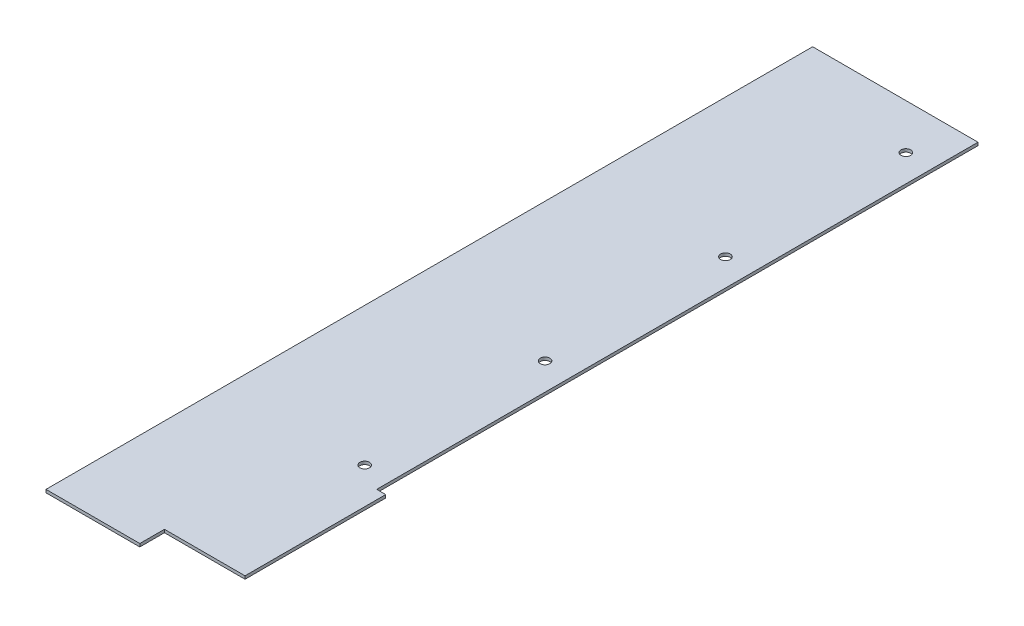
from build123d import *

# Parameters (mm, degrees)
ESQUISSE1_R        = 1.6
BOSS_EXTRU_1_DEPTH = 1


with BuildPart() as part:
    # Esquisse1 → Boss.-Extru.1 (new body)
    with BuildSketch(Plane(origin=(0, 0, 0), x_dir=(1, 0, 0), z_dir=(0, 1, 0))):
        Polygon((0, 0), (0, 255), (55, 255), (55, 55), (58, 55), (58, 8.2), (55, 8.2), (31.2, 8.2), (31.2, 0), align=None)
        with Locations(Location((46, 60, 0), (0, 0, 270))):
            Circle(ESQUISSE1_R, mode=Mode.SUBTRACT)
        with Locations(Location((46, 120, 0), (0, 0, 270))):
            Circle(ESQUISSE1_R, mode=Mode.SUBTRACT)
        with Locations(Location((46, 180, 0), (0, 0, 270))):
            Circle(ESQUISSE1_R, mode=Mode.SUBTRACT)
        with Locations(Location((46, 240, 0), (0, 0, 270))):
            Circle(ESQUISSE1_R, mode=Mode.SUBTRACT)
    extrude(amount=BOSS_EXTRU_1_DEPTH)


solid = part.part
